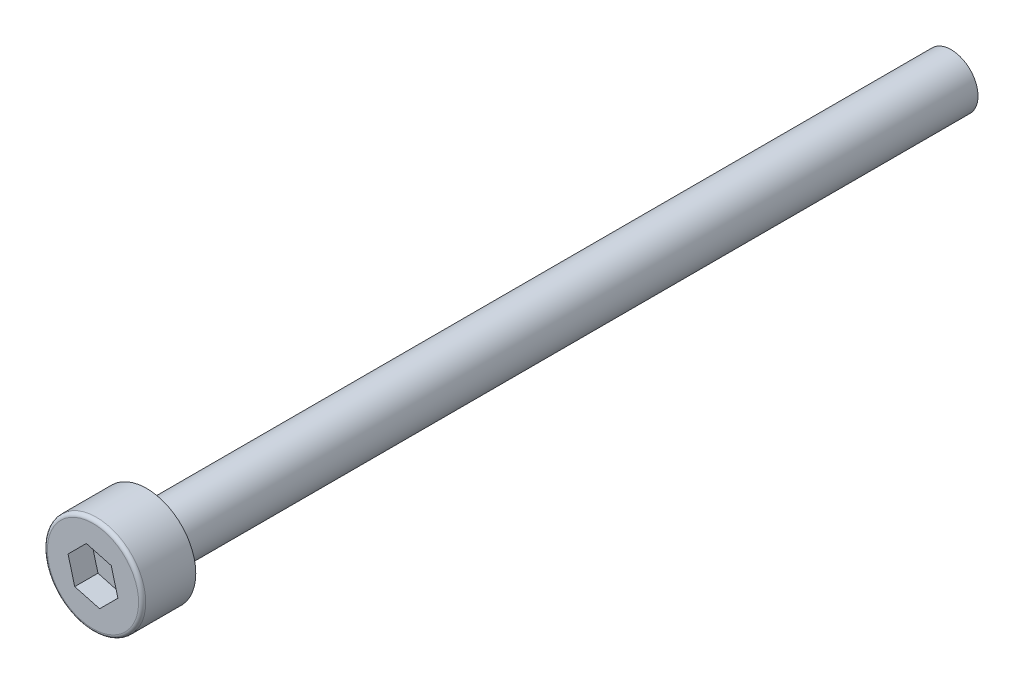
from build123d import *

# Parameters (mm, degrees)
SKETCH_1_R          = 2.75
EXTRUDE_1_DEPTH     = 3
CUT_EXTRUDE_1_DEPTH = 1.3
SKETCH_3_R          = 1.5
EXTRUDE_2_DEPTH     = 45
FILLET_1_R          = 0.2


with BuildPart() as part:
    # 草图1 → 凸台-拉伸1 (new body)
    with BuildSketch(Plane.XY):
        Circle(SKETCH_1_R)
    extrude(amount=EXTRUDE_1_DEPTH)

    # 草图2 → 切除-拉伸1 (cut)
    with BuildSketch(Plane.XY.offset(3)):
        Polygon((-1.020620726, -1.020620726), (0.373573113, -1.39419384), (1.39419384, -0.373573113), (1.020620726, 1.020620726), (-0.373573113, 1.39419384), (-1.39419384, 0.373573113), align=None)
    extrude(amount=-CUT_EXTRUDE_1_DEPTH, mode=Mode.SUBTRACT)

    # 草图3 → 凸台-拉伸2 (add)
    with BuildSketch(Plane(origin=(0, 0, 0), x_dir=(-1, 0, 0), z_dir=(0, 0, -1))):
        with Locations(Location((0, 0, 0), (0, 0, 180))):
            Circle(SKETCH_3_R)
    extrude(amount=EXTRUDE_2_DEPTH)

    # 圆角1
    fillet_1_edges = [part.edges().sort_by_distance(p)[0] for p in [
        (-2.75, 0, 3),
    ]]
    fillet(fillet_1_edges, radius=FILLET_1_R)


solid = part.part
